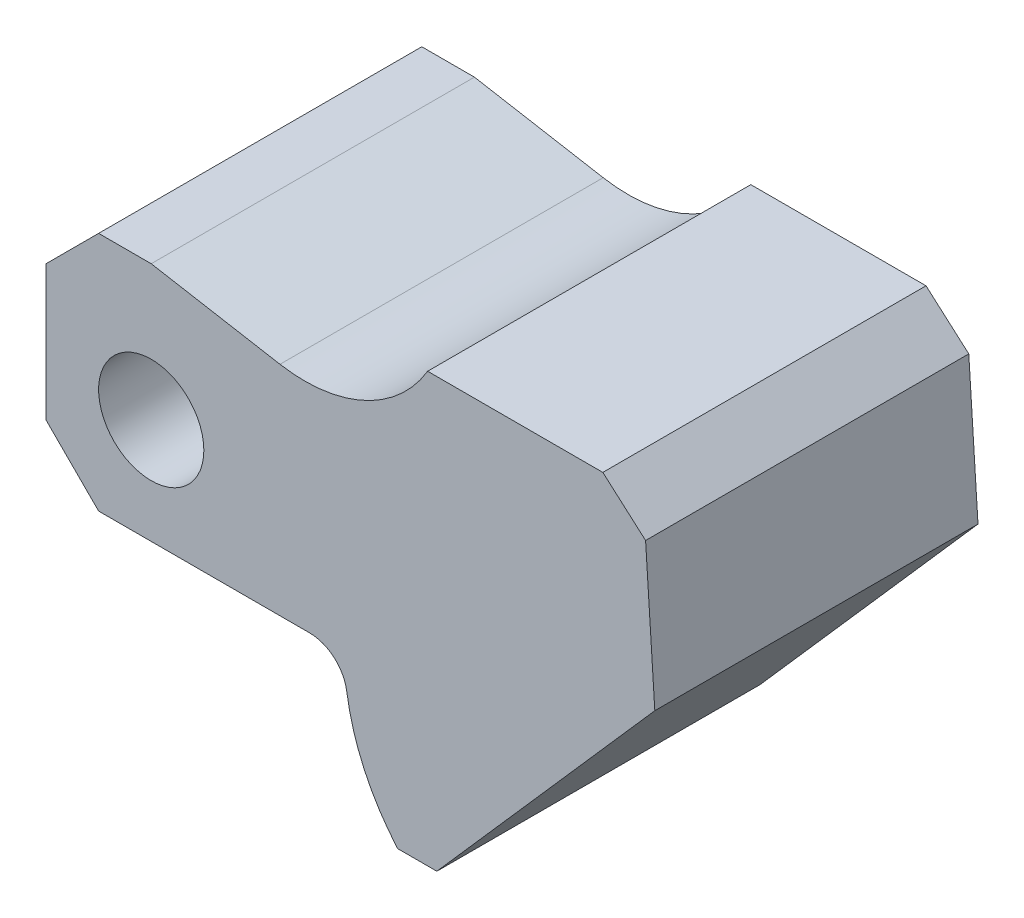
from build123d import *

# Parameters (mm, degrees)
SKETCH1_R           = 7
BOSS_EXTRUDE1_DEPTH = 43


with BuildPart() as part:
    # Sketch1 → Boss-Extrude1 (new body)
    with BuildSketch(Plane.XY):
        with BuildLine():
            Line((0, 0), (-7, 7))
            Line((-7, 7), (-7, 25))
            Line((-7, 25), (0, 32))
            Line((0, 32), (7, 32))
            Line((7, 32), (24.131881406, 28.979187078))
            ThreePointArc((24.131881406, 28.979187078), (35.36077259, 30.424329605), (43.774193548, 38))
            Line((43.774193548, 38), (67.084538376, 38))
            Line((67.084538376, 38), (72.774193548, 33))
            Line((72.774193548, 33), (74, 14))
            Line((74, 14), (45, -19))
            Line((45, -19), (39.788067397, -19))
            ThreePointArc((39.788067397, -19), (35.3490952, -12.115672061), (33.012264997, -4.264705882))
            ThreePointArc((33.012264997, -4.264705882), (31.331862036, -1.213413768), (28.066626255, 0))
            Line((28.066626255, 0), (0, 0))
        make_face()
        with Locations((7, 14)):
            Circle(SKETCH1_R, mode=Mode.SUBTRACT)
    extrude(amount=BOSS_EXTRUDE1_DEPTH)


solid = part.part
